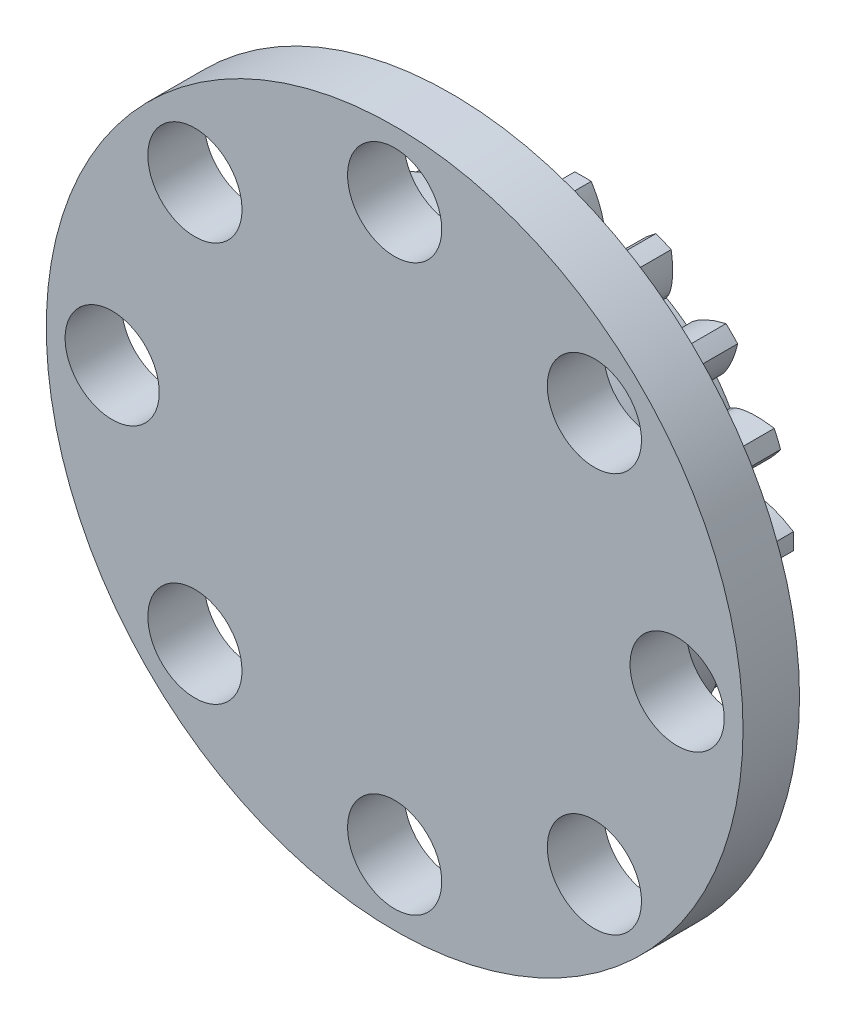
from build123d import *
from build123d.topology import SkipClean

# Parameters (mm, degrees)
SKETCH5_R           = 8.985916358
SKETCH5_R_2         = 1.5
EXTRUDE_BODY_DEPTH  = 2
EXTRUDE_TOOTH_DEPTH = 2
CIRPATTERN1_COUNT   = 16
SKETCH14_R          = 18.5
BOSS_EXTRUDE3_DEPTH = 3
SKETCH15_R          = 12
BOSS_EXTRUDE4_DEPTH = 3
SKETCH16_R          = 2.5
CUT_EXTRUDE1_DEPTH  = 28.083205154
CIRPATTERN2_COUNT   = 8
SKETCH17_R          = 4
CUT_EXTRUDE2_DEPTH  = 4


with BuildPart() as part:
    # Sketch5 → Extrude Body (new, symmetric)
    with BuildSketch(Plane.XY):
        Circle(SKETCH5_R)
        Circle(SKETCH5_R_2, mode=Mode.SUBTRACT)
    extrude(amount=EXTRUDE_BODY_DEPTH, both=True)

    # Sketch6 → Extrude Tooth (add, symmetric)
    with BuildSketch(Plane.XY):
        with BuildLine():
            Line((1.134921309, 9.161546615), (0.184408609, 1.48862133))
            ThreePointArc((0.184408609, 1.48862133), (0, 1.5), (-0.184408609, 1.48862133))
            Line((-0.184408609, 1.48862133), (-1.134921309, 9.161546615))
            add(Edge.make_bspline(
                [(-1.134921309, 9.161546615), (-1.145430024, 9.341646467), (-1.037717989, 10.059769916), (-0.721545889, 10.720196616), (-0.436951434, 11.177378861)],
                knots=[0, 0, 0, 0, 0.250023243, 1, 1, 1, 1], degree=3))
            ThreePointArc((-0.436951434, 11.177378861), (0, 11.185916358), (0.436951434, 11.177378861))
            add(Edge.make_bspline(
                [(1.134921309, 9.161546615), (1.145430024, 9.341646467), (1.037717989, 10.059769916), (0.721545889, 10.720196616), (0.436951434, 11.177378861)],
                knots=[0, 0, 0, 0, 0.250023243, 1, 1, 1, 1], degree=3))
        make_face()
    extrude_tooth = extrude(amount=EXTRUDE_TOOTH_DEPTH, both=True)

    # CirPattern1: Extrude Tooth ×16 about axis
    with SkipClean():  # the faces are left unmerged after this step: merging them gives an invalid solid
        cirpattern1_axis = Axis((0, 0, 2), (0, 0, -1))
        for i in range(1, CIRPATTERN1_COUNT):
            add(extrude_tooth.rotate(cirpattern1_axis, i * 360 / CIRPATTERN1_COUNT))



with BuildPart() as body_2:
    # Sketch14 → Boss-Extrude3 (new body)
    with BuildSketch(Plane.XY.offset(8)):
        Circle(SKETCH14_R)
    extrude(amount=-BOSS_EXTRUDE3_DEPTH)


with BuildPart() as part_1:
    with SkipClean():  # the faces are left unmerged after this step: merging them gives an invalid solid
        add(part.part)

        add(body_2.part)  # Boss-Extrude4 merges body 2
        # Sketch15 → Boss-Extrude4 (add)
        with BuildSketch(Plane(origin=(0, 0, 5), x_dir=(-1, 0, 0), z_dir=(0, 0, -1))):
            with Locations(Location((0, 0, 0), (0, 0, 180))):
                Circle(SKETCH15_R)
        extrude(amount=BOSS_EXTRUDE4_DEPTH)

    # Sketch16 → Cut-Extrude1 (cut, through all)
    with SkipClean():  # the faces are left unmerged after this step: merging them gives an invalid solid
        with BuildSketch(Plane.XY.offset(5)):
            with Locations((0, 15)):
                Circle(SKETCH16_R)
        cut_extrude1 = extrude(amount=CUT_EXTRUDE1_DEPTH, mode=Mode.SUBTRACT)

    # CirPattern2: Cut-Extrude1 ×8 about axis
    with SkipClean():  # the faces are left unmerged after this step: merging them gives an invalid solid
        cirpattern2_axis = Axis((0, 0, 0), (0, 0, 1))
        for i in range(1, CIRPATTERN2_COUNT):
            add(cut_extrude1.rotate(cirpattern2_axis, i * 360 / CIRPATTERN2_COUNT), mode=Mode.SUBTRACT)

    # Sketch17 → Cut-Extrude2 (cut)
    with BuildSketch(Plane(origin=(0, 0, -2), x_dir=(-1, 0, 0), z_dir=(0, 0, -1))):
        Circle(SKETCH17_R)
    extrude(amount=-CUT_EXTRUDE2_DEPTH, mode=Mode.SUBTRACT)


solid = part_1.part
